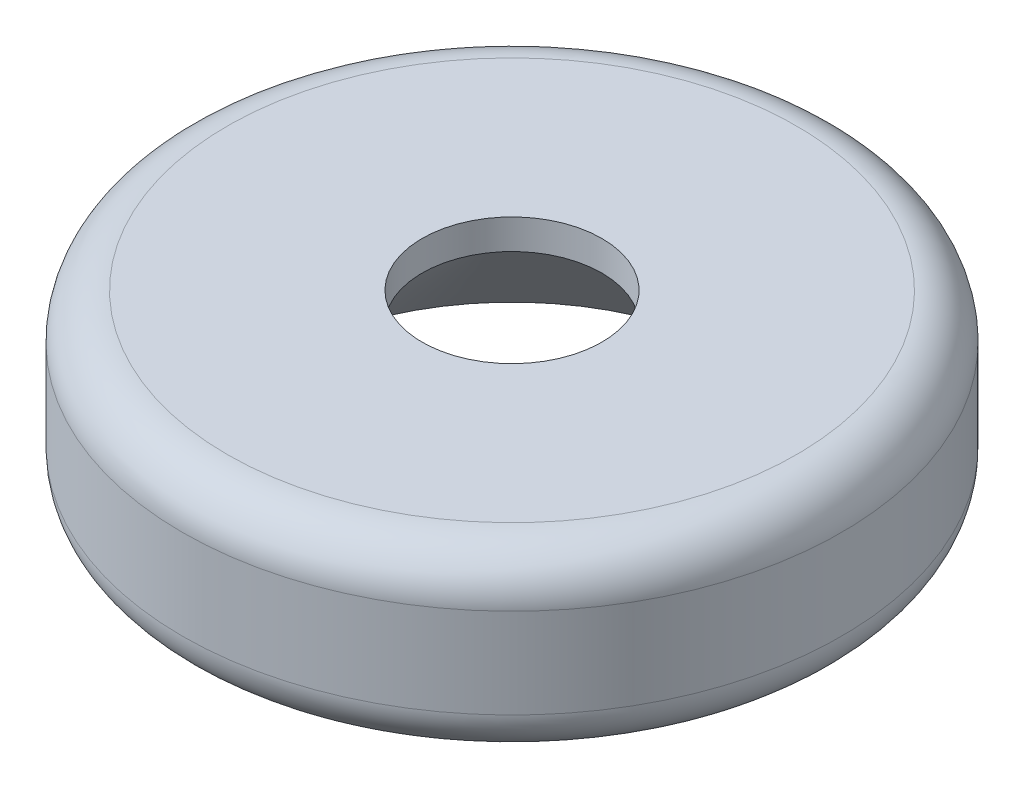
from build123d import *

# Parameters (mm, degrees)
ESBO_O1_R                = 11
RESSALTO_EXTRUS_O1_DEPTH = 6
ESBO_O10_R               = 8
CORTE_EXTRUS_O4_DEPTH    = 5
CORTE_EXTRUS_O4_DRAFT    = -45
ESBO_O11_R               = 3
CORTE_EXTRUS_O5_DEPTH    = 17.340134638
FILETE4_R                = 1.5
FILETE5_R                = 1.5


with BuildPart() as part:
    # Esboço1 → Ressalto-extrusão1 (new body)
    with BuildSketch(Plane(origin=(0, 0, 0), x_dir=(1, 0, 0), z_dir=(0, 1, 0))):
        with Locations(Location((0, 0, 0), (0, 0, 270))):
            Circle(ESBO_O1_R)
    extrude(amount=RESSALTO_EXTRUS_O1_DEPTH)


with BuildPart() as corte_extrus_o4_tool:
    # Esboço10 → Corte-extrusão4 (with draft: the straight prism first)
    with BuildSketch(Plane.XZ):
        Circle(ESBO_O10_R)
    extrude(amount=-CORTE_EXTRUS_O4_DEPTH)
    # Corte-extrusão4: the draft: its side faces are tilted about the plane it starts from
    corte_extrus_o4_sides = [corte_extrus_o4_tool.faces().sort_by_distance(p)[0] for p in [
        (-8, 2.5, 0),
    ]]
    draft(corte_extrus_o4_sides, Plane.XZ, CORTE_EXTRUS_O4_DRAFT)


with BuildPart() as part_1:
    add(part.part)

    # Corte-extrusão4: cut by corte_extrus_o4_tool
    add(corte_extrus_o4_tool.part, mode=Mode.SUBTRACT)

    # Esboço11 → Corte-extrusão5 (cut, through all)
    with BuildSketch(Plane.XZ.offset(-5)):
        with Locations(Location((0, 0, 0), (0, 0, 270))):
            Circle(ESBO_O11_R)
    extrude(amount=-CORTE_EXTRUS_O5_DEPTH, mode=Mode.SUBTRACT)

    # Filete4
    filete4_edges = [part_1.edges().sort_by_distance(p)[0] for p in [
        (0, 0, -11),
    ]]
    fillet(filete4_edges, radius=FILETE4_R)

    # Filete5
    filete5_edges = [part_1.edges().sort_by_distance(p)[0] for p in [
        (0, 6, -11),
    ]]
    fillet(filete5_edges, radius=FILETE5_R)


solid = part_1.part
